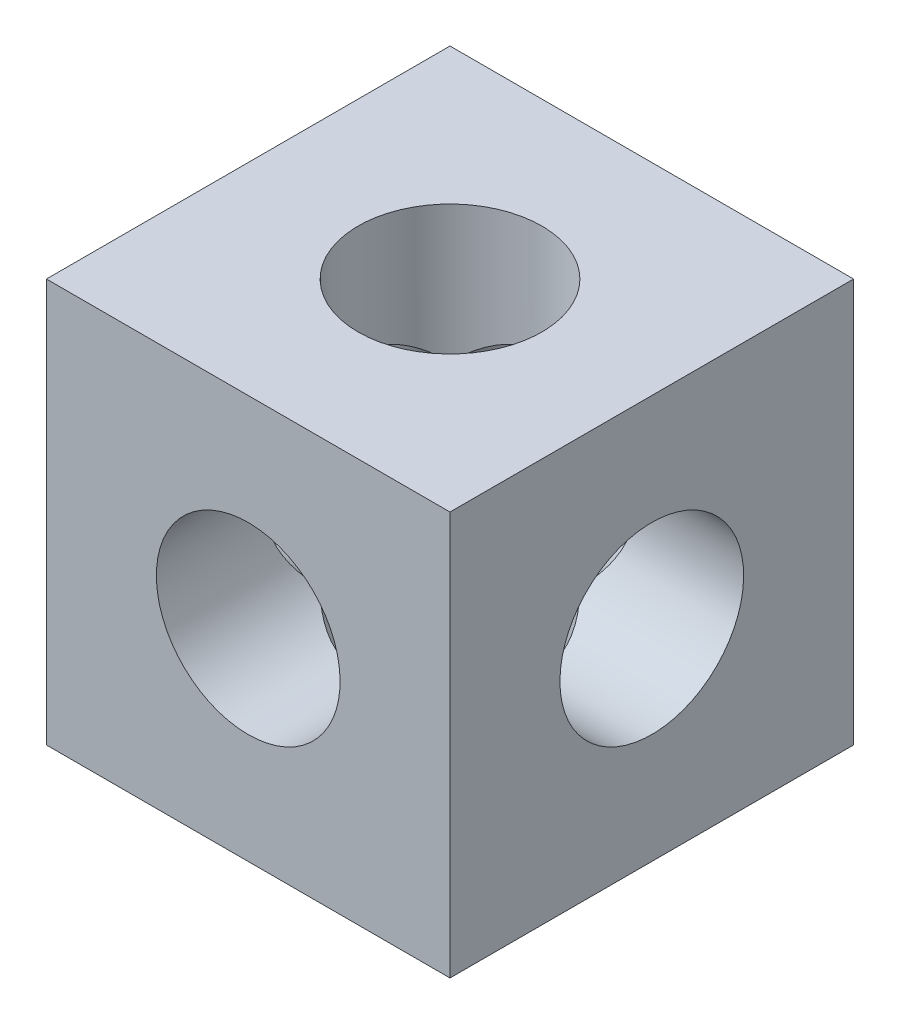
from build123d import *

# Parameters (mm, degrees)
SKETCH1_W                   = 34.925
SKETCH1_H                   = 34.925
CUBE_DEPTH                  = 34.925
SKETCH1_3_R                 = 7.9502
CUT_EXTRUDE1_DEPTH          = 61.491874454
CIRPATTERN2_COUNT           = 2
CIRPATTERN2_ANGLE           = 90
CIRPATTERN3_COPY_1_SKETCH_R = 7.9502
CIRPATTERN3_COPY_1_DEPTH    = 61.491874454
CIRPATTERN3_COPY_2_SKETCH_R = 7.9502
CIRPATTERN3_COPY_2_DEPTH    = 61.491874454


with BuildPart() as part:
    # Sketch1 → Cube (new body)
    with BuildSketch(Plane(origin=(0, 0, 0), x_dir=(1, 0, 0), z_dir=(0, 1, 0))):
        with Locations((17.4625, 17.4625)):
            Rectangle(SKETCH1_W, SKETCH1_H)
    extrude(amount=CUBE_DEPTH)

    # Sketch1<3> → Cut-Extrude1 (cut, through all)
    with BuildSketch(Plane(origin=(0, 0, 0), x_dir=(1, 0, 0), z_dir=(0, 1, 0))):
        with Locations((17.4625, 17.4625)):
            Circle(SKETCH1_3_R)
    cut_extrude1 = extrude(amount=CUT_EXTRUDE1_DEPTH, mode=Mode.SUBTRACT)

    # CirPattern2: Cut-Extrude1 ×2 about axis
    cirpattern2_axis = Axis((-1.74625, 17.4625, -17.4625), (1, 0, 0))
    for i in range(1, CIRPATTERN2_COUNT):
        add(cut_extrude1.rotate(cirpattern2_axis, i * CIRPATTERN2_ANGLE / (CIRPATTERN2_COUNT - 1)), mode=Mode.SUBTRACT)

    # CirPattern3 copy 1 sketch → CirPattern3 copy 1 (cut, through all)
    with BuildSketch(Plane(origin=(0, 34.925, -34.925), x_dir=(0, -1, 0), z_dir=(0, 0, 1))):
        with Locations((17.4625, 17.4625)):
            Circle(CIRPATTERN3_COPY_1_SKETCH_R)
    extrude(amount=CIRPATTERN3_COPY_1_DEPTH, mode=Mode.SUBTRACT)

    # CirPattern3 copy 2 sketch → CirPattern3 copy 2 (cut, through all)
    with BuildSketch(Plane(origin=(0, 34.925, 0), x_dir=(0, -1, 0), z_dir=(1, 0, 0))):
        with Locations((17.4625, 17.4625)):
            Circle(CIRPATTERN3_COPY_2_SKETCH_R)
    extrude(amount=CIRPATTERN3_COPY_2_DEPTH, mode=Mode.SUBTRACT)


solid = part.part
